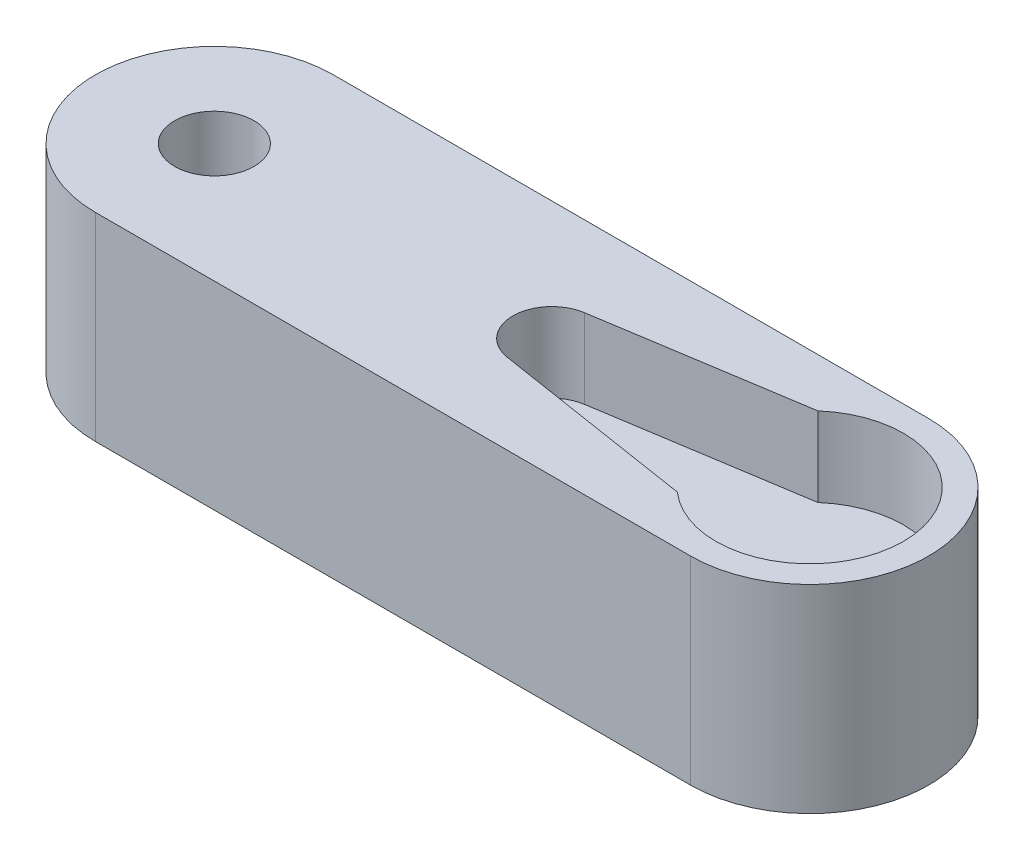
from build123d import *

# Parameters (mm, degrees)
BOSS_EXTRUDE1_DEPTH = 12.7
SKETCH4_R           = 2.54
CUT_EXTRUDE3_DEPTH  = 43.063657711
CUT_EXTRUDE4_DEPTH  = 5.08


with BuildPart() as part:
    # Sketch3 → Boss-Extrude1 (new body)
    with BuildSketch(Plane(origin=(0, 0, 0), x_dir=(1, 0, 0), z_dir=(0, 1, 0))):
        with BuildLine():
            Line((-31.75, 7.62), (6.35, 7.62))
            ThreePointArc((6.35, 7.62), (13.97, 0), (6.35, -7.62))
            Line((6.35, -7.62), (-31.75, -7.62))
            ThreePointArc((-31.75, -7.62), (-39.37, 0), (-31.75, 7.62))
        make_face()
    extrude(amount=BOSS_EXTRUDE1_DEPTH)

    # Sketch4 → Cut-Extrude3 (cut, through all)
    with BuildSketch(Plane(origin=(0, 12.7, 0), x_dir=(1, 0, 0), z_dir=(0, 1, 0))):
        with Locations(Location((-31.75, 0, 0), (0, 0, 270))):
            Circle(SKETCH4_R)
    extrude(amount=-CUT_EXTRUDE3_DEPTH, mode=Mode.SUBTRACT)

    # Sketch5 → Cut-Extrude4 (cut)
    with BuildSketch(Plane(origin=(0, 12.7, 0), x_dir=(1, 0, 0), z_dir=(0, 1, 0))):
        with BuildLine():
            Line((-10.538123317, -2.469691065), (2.38137089, -4.50000243))
            ThreePointArc((2.38137089, -4.50000243), (12.35000324, 0), (2.38137089, 4.50000243))
            Line((2.38137089, 4.50000243), (-10.538123317, 2.469691065))
            ThreePointArc((-10.538123317, 2.469691065), (-12.65001026, 0), (-10.538123317, -2.469691065))
        make_face()
    extrude(amount=-CUT_EXTRUDE4_DEPTH, mode=Mode.SUBTRACT)


solid = part.part
